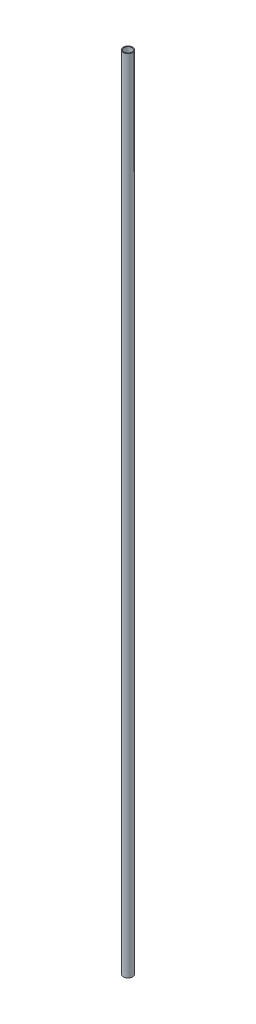
from build123d import *

# Parameters (mm, degrees)
SKETCH1_R      = 2.35
SKETCH1_R_2    = 1.95
EXTRUDE1_DEPTH = 400


with BuildPart() as part:
    # Sketch1 → Extrude1 (new body)
    with BuildSketch(Plane(origin=(0, 0, 0), x_dir=(1, 0, 0), z_dir=(0, 1, 0))):
        with Locations(Location((0, 0, 0), (0, 0, 270))):
            Circle(SKETCH1_R)
        with Locations(Location((0, 0, 0), (0, 0, 270))):
            Circle(SKETCH1_R_2, mode=Mode.SUBTRACT)
    extrude(amount=EXTRUDE1_DEPTH)


solid = part.part
